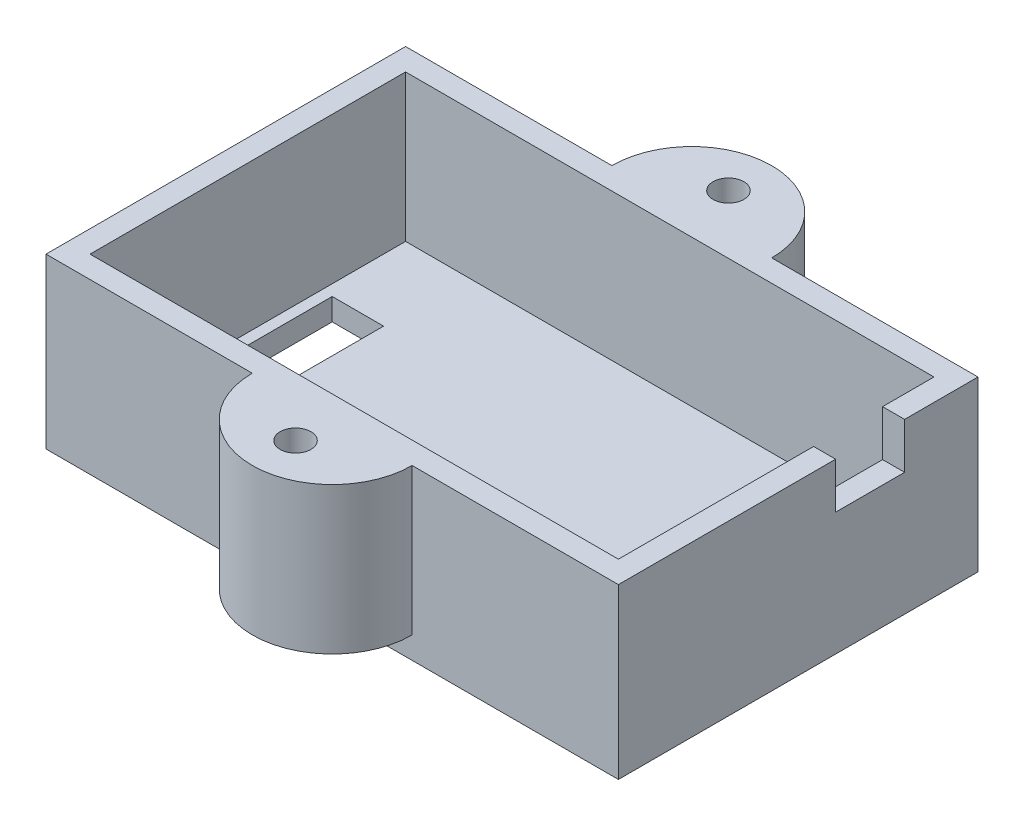
from build123d import *

# Parameters (mm, degrees)
SKETCH1_R           = 2.1
SKETCH1_W           = 72
SKETCH1_H           = 43
BOSS_EXTRUDE1_DEPTH = 20
SKETCH2_W           = 78
SKETCH2_H           = 49
BOSS_EXTRUDE2_DEPTH = 3
SKETCH3_W           = 7
SKETCH3_H           = 20
CUT_EXTRUDE1_DEPTH  = 10
SKETCH4_W           = 9.4
SKETCH4_H           = 6.25
CUT_EXTRUDE2_DEPTH  = 10


with BuildPart() as part:
    # Sketch1 → Boss-Extrude1 (new body)
    with BuildSketch(Plane(origin=(0, 0, 0), x_dir=(1, 0, 0), z_dir=(0, 1, 0))):
        with BuildLine():
            Line((-39, 24.5), (-39, 10.886061931))
            Line((-39, 10.886061931), (-39, -10.886061931))
            Line((-39, -10.886061931), (-39, -24.5))
            Line((-39, -24.5), (-10.89, -24.5))
            ThreePointArc((-10.89, -24.5), (0, -35.39), (10.89, -24.5))
            Line((10.89, -24.5), (39, -24.5))
            Line((39, -24.5), (39, -10.886061931))
            Line((39, -10.886061931), (39, 10.886061931))
            Line((39, 10.886061931), (39, 24.5))
            Line((39, 24.5), (10.89, 24.5))
            ThreePointArc((10.89, 24.5), (0, 35.39), (-10.89, 24.5))
            Line((-10.89, 24.5), (-39, 24.5))
        make_face()
        with Locations(Location((0, -29.5, 0), (0, 0, 270))):
            Circle(SKETCH1_R, mode=Mode.SUBTRACT)
        with Locations(Location((0, 29.5, 0), (0, 0, 270))):
            Circle(SKETCH1_R, mode=Mode.SUBTRACT)
        Rectangle(SKETCH1_W, SKETCH1_H, mode=Mode.SUBTRACT)
    extrude(amount=BOSS_EXTRUDE1_DEPTH)

    # Sketch2 → Boss-Extrude2 (add)
    with BuildSketch(Plane.XZ):
        Rectangle(SKETCH2_W, SKETCH2_H)
    extrude(amount=BOSS_EXTRUDE2_DEPTH)

    # Sketch3 → Cut-Extrude1 (cut)
    with BuildSketch(Plane(origin=(0, 0, 0), x_dir=(1, 0, 0), z_dir=(0, 1, 0))):
        with Locations((-31, 0)):
            Rectangle(SKETCH3_W, SKETCH3_H)
    extrude(amount=-CUT_EXTRUDE1_DEPTH, mode=Mode.SUBTRACT)

    # Sketch4 → Cut-Extrude2 (cut)
    with BuildSketch(Plane(origin=(39, 0, 0), x_dir=(0, 0, -1), z_dir=(1, 0, 0))):
        with Locations((9.8, 16.875)):
            Rectangle(SKETCH4_W, SKETCH4_H)
    extrude(amount=-CUT_EXTRUDE2_DEPTH, mode=Mode.SUBTRACT)


solid = part.part
